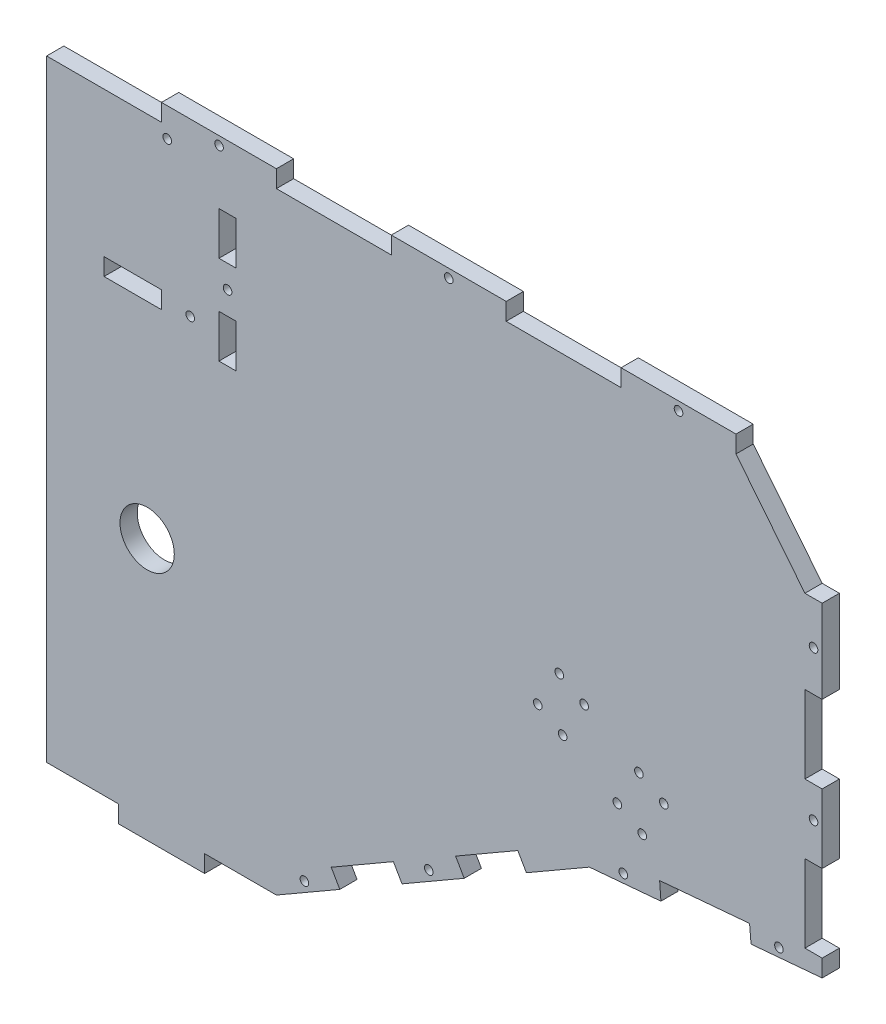
from build123d import *

# Parameters (mm, degrees)
ESQUISSE1_W                   = 270
ESQUISSE1_H                   = 213
BOSS_EXTRU_1_DEPTH            = 6
ESQUISSE3_R                   = 9.45
ESQUISSE3_R_2                 = 1.5
ENL_V_MAT_EXTRU_1_DEPTH       = 10
ENL_V_MAT_EXTRU_11_DEPTH      = 173.055950202
ENL_V_MAT_EXTRU_11_DEPTH_BACK = 173.055950202
ESQUISSE6_W                   = 40
ESQUISSE6_H                   = 6
BOSS_EXTRU_2_DEPTH            = 6
ESQUISSE7_W                   = 6
ESQUISSE7_H                   = 30
ESQUISSE7_H_2                 = 27
ENL_V_MAT_EXTRU_12_DEPTH      = 6
ESQUISSE8_W                   = 30
ESQUISSE8_H                   = 6
BOSS_EXTRU_3_DEPTH            = 6
ENL_V_MAT_EXTRU_13_DEPTH      = 176.833017377
ENL_V_MAT_EXTRU_14_DEPTH      = 10
ESQUISSE11_W                  = 6
ESQUISSE11_H                  = 15
ENL_V_MAT_EXTRU_15_DEPTH      = 176.833017377
ENL_V_MAT_EXTRU_17_DEPTH      = 176.833017377
ESQUISSE15_R                  = 2.995
ESQUISSE15_R_2                = 2.95
ESQUISSE15_R_3                = 3
ENL_V_MAT_EXTRU_19_DEPTH      = 3
ESQUISSE16_R                  = 1.5
ENL_V_MAT_EXTRU_20_DEPTH      = 10
ESQUISSE17_W                  = 20
ESQUISSE17_H                  = 6
ENL_V_MAT_EXTRU_22_DEPTH      = 10


with BuildPart() as part:
    # Esquisse1 → Boss.-Extru.1 (new body)
    with BuildSketch(Plane.XY):
        Rectangle(ESQUISSE1_W, ESQUISSE1_H)
    extrude(amount=BOSS_EXTRU_1_DEPTH)

    # Esquisse3 → Enlèv. mat.-Extru.1 (cut)
    with BuildSketch(Plane.XY.offset(6)):
        with Locations((-100, -21.5)):
            Circle(ESQUISSE3_R)
        with Locations((43.489676576, 9.523710062)):
            Circle(ESQUISSE3_R_2)
        with Locations((52.149930614, 4.523710062)):
            Circle(ESQUISSE3_R_2)
        with Locations((35.989676576, -3.466670994)):
            Circle(ESQUISSE3_R_2)
        with Locations((44.649930614, -8.466670994)):
            Circle(ESQUISSE3_R_2)
        with Locations((63.702489497, -19.466670994)):
            Circle(ESQUISSE3_R_2)
        with Locations((72.362743535, -24.466670994)):
            Circle(ESQUISSE3_R_2)
        with Locations((79.862743535, -11.476289938)):
            Circle(ESQUISSE3_R_2)
        with Locations((71.202489497, -6.476289938)):
            Circle(ESQUISSE3_R_2)
    extrude(amount=-ENL_V_MAT_EXTRU_1_DEPTH, mode=Mode.SUBTRACT)

    # Esquisse5 → Enlèv. mat.-Extru.11 (cut, two sides: drawn at the far end of the back side and taken through both)
    with BuildSketch(Plane.XY.offset(6).offset(-ENL_V_MAT_EXTRU_11_DEPTH_BACK)):
        Polygon((135, -36.5), (53.963742643, -43.589753853), (-55, -106.5), (135, -106.5), align=None)
    extrude(amount=ENL_V_MAT_EXTRU_11_DEPTH + ENL_V_MAT_EXTRU_11_DEPTH_BACK, mode=Mode.SUBTRACT)

    # Esquisse6 → Boss.-Extru.2 (add)
    with BuildSketch(Plane(origin=(0, 106.5, 0), x_dir=(1, 0, 0), z_dir=(0, 1, 0))):
        with Locations((-75, -3)):
            Rectangle(ESQUISSE6_W, ESQUISSE6_H)
        with Locations((5, -3)):
            Rectangle(ESQUISSE6_W, ESQUISSE6_H)
        with Locations((85, -3)):
            Rectangle(ESQUISSE6_W, ESQUISSE6_H)
    extrude(amount=BOSS_EXTRU_2_DEPTH)

    # Esquisse7 → Enlèv. mat.-Extru.12 (cut)
    with BuildSketch(Plane(origin=(0, 0, 0), x_dir=(-1, 0, 0), z_dir=(0, 0, -1))):
        with Locations((-132, 91.5)):
            Rectangle(ESQUISSE7_W, ESQUISSE7_H)
        with Locations((-132, 34)):
            Rectangle(ESQUISSE7_W, ESQUISSE7_H_2)
        with Locations((-132, -17)):
            Rectangle(ESQUISSE7_W, ESQUISSE7_H_2)
    extrude(amount=-ENL_V_MAT_EXTRU_12_DEPTH, mode=Mode.SUBTRACT)

    # Esquisse8 → Boss.-Extru.3 (add)
    with BuildSketch(Plane.XZ.offset(106.5)):
        with Locations((-95, 3)):
            Rectangle(ESQUISSE8_W, ESQUISSE8_H)
    extrude(amount=BOSS_EXTRU_3_DEPTH)

    # Esquisse9 → Enlèv. mat.-Extru.13 (cut, through all)
    with BuildSketch(Plane(origin=(0, 0, 0), x_dir=(-1, 0, 0), z_dir=(0, 0, -1))):
        Polygon((-110.25, -38.665344422), (-109.727065544, -32.688176234), (-78.422975963, -35.411286132), (-78.863742643, -41.411286132), align=None)
    extrude(amount=-ENL_V_MAT_EXTRU_13_DEPTH, mode=Mode.SUBTRACT)

    # Esquisse10 → Enlèv. mat.-Extru.14 (cut)
    with BuildSketch(Plane(origin=(0, 0, 0), x_dir=(-1, 0, 0), z_dir=(0, 0, -1))):
        Polygon((-32.03555308, -56.25), (-10.384917986, -68.75), (-7.384917986, -63.553847577), (-29.03555308, -51.053847577), align=None)
        Polygon((11.265717109, -81.25), (32.916352203, -93.75), (35.916352203, -88.553847577), (14.265717109, -76.053847577), align=None)
    extrude(amount=-ENL_V_MAT_EXTRU_14_DEPTH, mode=Mode.SUBTRACT)

    # Esquisse11 → Enlèv. mat.-Extru.15 (cut, through all)
    with BuildSketch(Plane(origin=(0, 0, 0), x_dir=(-1, 0, 0), z_dir=(0, 0, -1))):
        with Locations((72, 52)):
            Rectangle(ESQUISSE11_W, ESQUISSE11_H)
        with Locations((72, 83)):
            Rectangle(ESQUISSE11_W, ESQUISSE11_H)
    extrude(amount=-ENL_V_MAT_EXTRU_15_DEPTH, mode=Mode.SUBTRACT)

    # Esquisse13 → Enlèv. mat.-Extru.17 (cut, through all)
    with BuildSketch(Plane(origin=(0, 0, 0), x_dir=(-1, 0, 0), z_dir=(0, 0, -1))):
        Polygon((-129, 76.5), (-129, 106.5), (-105, 106.5), align=None)
    extrude(amount=-ENL_V_MAT_EXTRU_17_DEPTH, mode=Mode.SUBTRACT)

    # Esquisse15 → Enlèv. mat.-Extru.19 (cut)
    with BuildSketch(Plane(origin=(0, 0, 0), x_dir=(-1, 0, 0), z_dir=(0, 0, -1))):
        with Locations((-85, 109.5)):
            Circle(ESQUISSE15_R)
        with Locations((-5, 109.5)):
            Circle(ESQUISSE15_R)
        with Locations((75, 109.5)):
            Circle(ESQUISSE15_R)
        with Locations((1.940399562, -72.401923789)):
            Circle(ESQUISSE15_R)
        with Locations((-65.76712105, -39.571035308)):
            Circle(ESQUISSE15_R)
        with Locations((45.241669751, -97.401923789)):
            Circle(ESQUISSE15_R_2)
        with Locations((-132, 9.551106058)):
            Circle(ESQUISSE15_R)
        with Locations((-132, 61.579483335)):
            Circle(ESQUISSE15_R)
        with Locations((-119.950479753, -34.805202901)):
            Circle(ESQUISSE15_R)
        with Locations((72, 67.5)):
            Circle(ESQUISSE15_R_3)
        with Locations((85, 53)):
            Circle(ESQUISSE15_R_3)
    extrude(amount=-ENL_V_MAT_EXTRU_19_DEPTH, mode=Mode.SUBTRACT)

    # Esquisse16 → Enlèv. mat.-Extru.20 (cut)
    with BuildSketch(Plane(origin=(0, 0, 0), x_dir=(-1, 0, 0), z_dir=(0, 0, -1))):
        with Locations((-5, 109.5)):
            Circle(ESQUISSE16_R)
        with Locations((74.967795866, 109.5)):
            Circle(ESQUISSE16_R)
        with Locations((-85, 109.5)):
            Circle(ESQUISSE16_R)
        with Locations((-132, 61.579483335)):
            Circle(ESQUISSE16_R)
        with Locations((-132, 9.551106058)):
            Circle(ESQUISSE16_R)
        with Locations((-119.950479753, -34.805202901)):
            Circle(ESQUISSE16_R)
        with Locations((-65.76712105, -39.571035308)):
            Circle(ESQUISSE16_R)
        with Locations((1.940399562, -72.401923789)):
            Circle(ESQUISSE16_R)
        with Locations((45.241669751, -97.401923789)):
            Circle(ESQUISSE16_R)
        with Locations((72, 67.5)):
            Circle(ESQUISSE16_R)
        with Locations((85, 53)):
            Circle(ESQUISSE16_R)
        with Locations((93, 102.5)):
            Circle(ESQUISSE16_R)
    extrude(amount=-ENL_V_MAT_EXTRU_20_DEPTH, mode=Mode.SUBTRACT)

    # Esquisse17 → Enlèv. mat.-Extru.22 (cut)
    with BuildSketch(Plane(origin=(0, 0, 0), x_dir=(-1, 0, 0), z_dir=(0, 0, -1))):
        with Locations((105, 53)):
            Rectangle(ESQUISSE17_W, ESQUISSE17_H)
    extrude(amount=-ENL_V_MAT_EXTRU_22_DEPTH, mode=Mode.SUBTRACT)


solid = part.part
